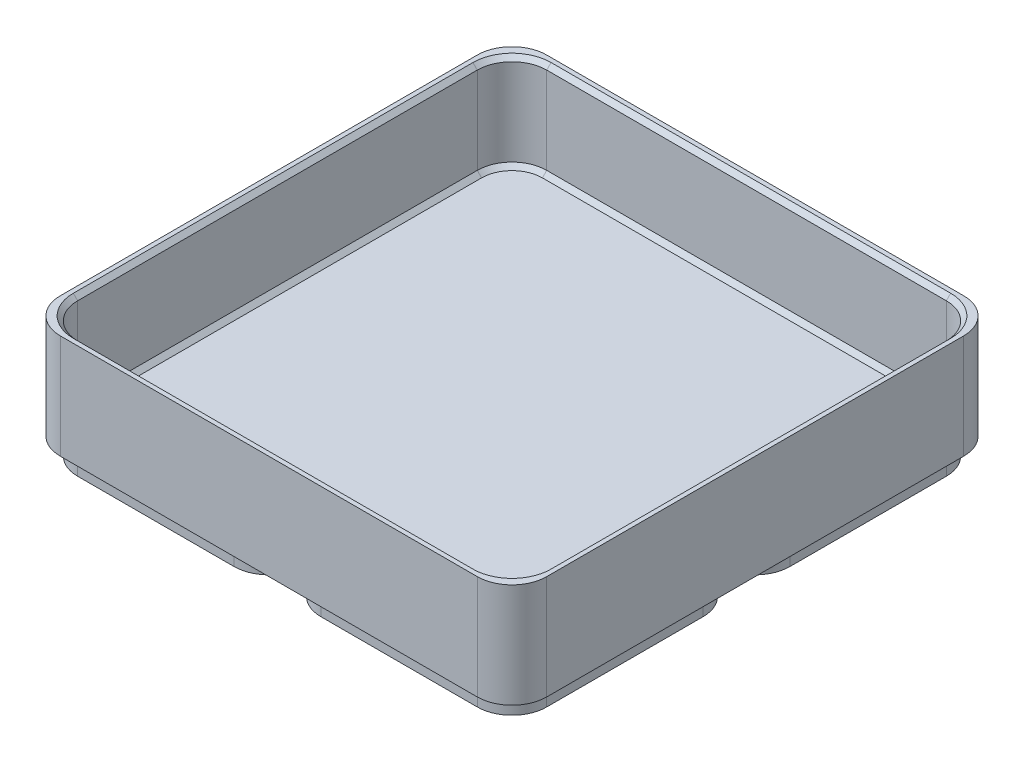
from build123d import *

# Parameters (mm, degrees)
BOSS_EXTRUDE4_DEPTH = 5
SKETCH6_W           = 70
SKETCH6_H           = 70
BOSS_EXTRUDE5_DEPTH = 30
SKETCH8_R           = 3
CUT_EXTRUDE1_DEPTH  = 2
CUT_EXTRUDE3_START  = -30
CUT_EXTRUDE3_DEPTH  = 30
SKETCH10_W          = 140
SKETCH10_H          = 140
BOSS_EXTRUDE6_DEPTH = 2.5
FILLET1_R           = 10
CHAMFER1_SIZE       = 1.25


with BuildPart() as part:
    # Sketch5 → Boss-Extrude4 (new body)
    with BuildSketch(Plane(origin=(0, 0, 0), x_dir=(1, 0, 0), z_dir=(0, 1, 0))):
        with BuildLine():
            Line((-22.5, -32.5), (22.5, -32.5))
            ThreePointArc((22.5, -32.5), (29.571067812, -29.571067812), (32.5, -22.5))
            Line((32.5, -22.5), (32.5, 22.5))
            ThreePointArc((32.5, 22.5), (29.571067812, 29.571067812), (22.5, 32.5))
            Line((22.5, 32.5), (-22.5, 32.5))
            ThreePointArc((-22.5, 32.5), (-29.571067812, 29.571067812), (-32.5, 22.5))
            Line((-32.5, 22.5), (-32.5, -22.5))
            ThreePointArc((-32.5, -22.5), (-29.571067812, -29.571067812), (-22.5, -32.5))
        make_face()
    extrude(amount=BOSS_EXTRUDE4_DEPTH)

    # Sketch6 → Boss-Extrude5 (add)
    with BuildSketch(Plane(origin=(0, 5, 0), x_dir=(1, 0, 0), z_dir=(0, 1, 0))):
        Rectangle(SKETCH6_W, SKETCH6_H)
    extrude(amount=BOSS_EXTRUDE5_DEPTH)

    # Sketch8 → Cut-Extrude1 (cut)
    with BuildSketch(Plane.XZ):
        with Locations((-26.035533906, 26.035533906)):
            Circle(SKETCH8_R)
        with Locations((26.036533906, 26.036533906)):
            Circle(SKETCH8_R)
        with Locations((26.037533906, -26.035533906)):
            Circle(SKETCH8_R)
        with Locations((-26.034533906, -26.036533906)):
            Circle(SKETCH8_R)
    extrude(amount=-CUT_EXTRUDE1_DEPTH, mode=Mode.SUBTRACT)

    # Mirror1: part across plane


with BuildPart() as part_1:
    add(part.part)
    add(part.part.mirror(Plane(origin=(-35, 35, -35), x_dir=(0, 0, 1), z_dir=(1, 0, 0))))

    # Mirror2: part across plane


with BuildPart() as part_2:
    add(part_1.part)
    add(part_1.part.mirror(Plane(origin=(35, 35, 35), x_dir=(1, 0, 0), z_dir=(0, 0, -1))))

    # Sketch9 → Cut-Extrude3 (cut)
    with BuildSketch(Plane(origin=(0, 35, 0), x_dir=(1, 0, 0), z_dir=(0, 1, 0)).offset(CUT_EXTRUDE3_START)):
        with BuildLine():
            Line((22.5, 32.5), (-92.5, 32.5))
            ThreePointArc((-92.5, 32.5), (-99.571067812, 29.571067812), (-102.5, 22.5))
            Line((-102.5, 22.5), (-102.5, -92.5))
            ThreePointArc((-102.5, -92.5), (-99.571067812, -99.571067812), (-92.5, -102.5))
            Line((-92.5, -102.5), (22.5, -102.5))
            ThreePointArc((22.5, -102.5), (29.571067812, -99.571067812), (32.5, -92.5))
            Line((32.5, -92.5), (32.5, 22.5))
            ThreePointArc((32.5, 22.5), (29.571067812, 29.571067812), (22.5, 32.5))
        make_face()
    extrude(amount=CUT_EXTRUDE3_DEPTH, mode=Mode.SUBTRACT)


with BuildPart() as cut_extrude3_piece_1:
    # of the separate pieces the step leaves, piece 1, a body of its own (cut_extrude3_pieces)
    add(part_2.part.solids().sort_by_distance((35, 5, -35))[0])

    # Sketch10 → Boss-Extrude6 (add)
    with BuildSketch(Plane.XZ.offset(-5)):
        with Locations((-35, 35)):
            Rectangle(SKETCH10_W, SKETCH10_H)
    extrude(amount=-BOSS_EXTRUDE6_DEPTH)


with BuildPart() as cut_extrude3_piece_2:
    # of the separate pieces the step leaves, piece 2, a body of its own (cut_extrude3_pieces)
    add(part_2.part.solids().sort_by_distance((-92.5, 0, -32.5))[0])


with BuildPart() as cut_extrude3_piece_3:
    # of the separate pieces the step leaves, piece 3, a body of its own (cut_extrude3_pieces)
    add(part_2.part.solids().sort_by_distance((-102.5, 0, 47.5))[0])


with BuildPart() as cut_extrude3_piece_4:
    # of the separate pieces the step leaves, piece 4, a body of its own (cut_extrude3_pieces)
    add(part_2.part.solids().sort_by_distance((22.5, 0, 102.5))[0])


with BuildPart() as cut_extrude3_piece_5:
    # of the separate pieces the step leaves, piece 5, a body of its own (cut_extrude3_pieces)
    add(part_2.part.solids().sort_by_distance((32.5, 0, 22.5))[0])


with BuildPart() as cut_extrude3_piece_3_1:
    add(cut_extrude3_piece_3.part)

    # Combine1: union Cut-Extrude3 piece 5, Cut-Extrude3 piece 2, Cut-Extrude3 piece 4, Cut-Extrude3 piece 1
    add(cut_extrude3_piece_5.part)
    add(cut_extrude3_piece_2.part)
    add(cut_extrude3_piece_4.part)
    add(cut_extrude3_piece_1.part)

    # Fillet1
    fillet1_edges = [cut_extrude3_piece_3_1.edges().sort_by_distance(p)[0] for p in [
        (-105, 20, -35),
        (-105, 20, 105),
        (35, 20, 105),
        (35, 20, -35),
    ]]
    fillet(fillet1_edges, radius=FILLET1_R)

    # Chamfer1
    chamfer1_edges = [cut_extrude3_piece_3_1.edges().sort_by_distance(p)[0] for p in [
        (-35, 7.5, 102.5),
        (29.571067812, 7.5, 99.571067812),
        (-99.571067812, 7.5, 99.571067812),
        (32.5, 7.5, 35),
        (-102.5, 7.5, 35),
        (29.571067812, 7.5, -29.571067812),
        (-99.571067812, 7.5, -29.571067812),
        (-35, 7.5, -32.5),
        (29.571067812, 35, 99.571067812),
        (32.5, 35, 35),
        (-35, 35, 102.5),
        (29.571067812, 35, -29.571067812),
        (-99.571067812, 35, 99.571067812),
        (-35, 35, -32.5),
        (-102.5, 35, 35),
        (-99.571067812, 35, -29.571067812),
    ]]
    chamfer(chamfer1_edges, length=CHAMFER1_SIZE)


solid = cut_extrude3_piece_3_1.part
